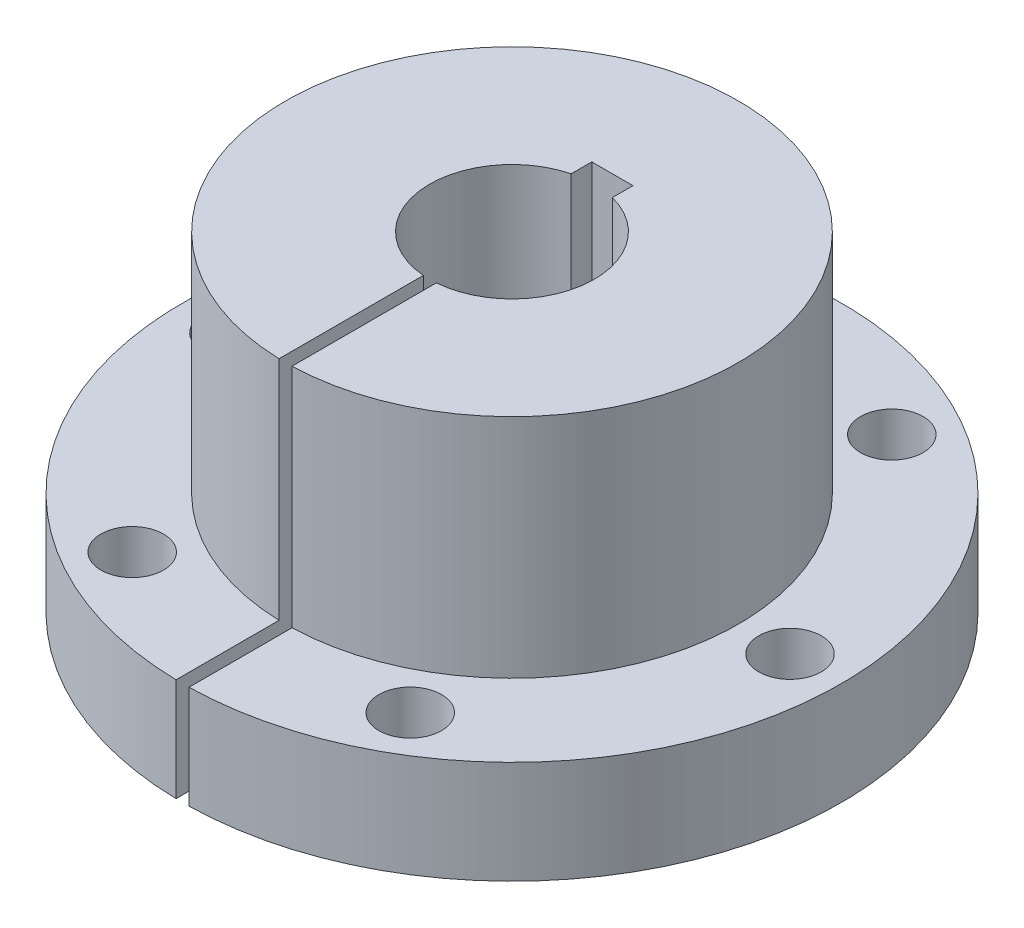
from build123d import *

# Parameters (mm, degrees)
SKETCH1_R           = 25.4
BOSS_EXTRUDE1_DEPTH = 7.9375
SKETCH2_R           = 17.4625
BOSS_EXTRUDE2_DEPTH = 17.4625
CUT_EXTRUDE1_DEPTH  = 44.994090512
SKETCH4_R           = 2.413
CUT_EXTRUDE2_DEPTH  = 40.940692361
CIRPATTERN1_COUNT   = 6


with BuildPart() as part:
    # Sketch1 → Boss-Extrude1 (new body)
    with BuildSketch(Plane(origin=(0, 0, 0), x_dir=(1, 0, 0), z_dir=(0, 1, 0))):
        with Locations(Location((0, 0, 0), (0, 0, 270))):
            Circle(SKETCH1_R)
    extrude(amount=BOSS_EXTRUDE1_DEPTH)

    # Sketch2 → Boss-Extrude2 (add)
    with BuildSketch(Plane(origin=(0, 7.9375, 0), x_dir=(1, 0, 0), z_dir=(0, 1, 0))):
        with Locations(Location((0, 0, 0), (0, 0, 270))):
            Circle(SKETCH2_R)
    extrude(amount=BOSS_EXTRUDE2_DEPTH)

    # Sketch3 → Cut-Extrude1 (cut, through all)
    with BuildSketch(Plane(origin=(0, 25.4, 0), x_dir=(1, 0, 0), z_dir=(0, 1, 0))):
        with BuildLine():
            Line((-1.5875, 7.735861062), (1.5875, 7.735861062))
            Line((1.5875, 7.735861062), (1.5875, 6.148361062))
            ThreePointArc((1.5875, 6.148361062), (6.326022598, -0.551305799), (0.5, -6.330284354))
            Line((0.5, -6.330284354), (0.5, -25.4))
            Line((0.5, -25.4), (-0.5, -25.4))
            Line((-0.5, -25.4), (-0.5, -6.330284354))
            ThreePointArc((-0.5, -6.330284354), (-6.326022598, -0.551305799), (-1.5875, 6.148361062))
            Line((-1.5875, 6.148361062), (-1.5875, 7.735861062))
        make_face()
    extrude(amount=-CUT_EXTRUDE1_DEPTH, mode=Mode.SUBTRACT)

    # Sketch4 → Cut-Extrude2 (cut, through all)
    with BuildSketch(Plane(origin=(0, 7.9375, 0), x_dir=(1, 0, 0), z_dir=(0, 1, 0))):
        with Locations(Location((-21.43125, 0, 0), (0, 0, 270))):
            Circle(SKETCH4_R)
    cut_extrude2 = extrude(amount=-CUT_EXTRUDE2_DEPTH, mode=Mode.SUBTRACT)

    # CirPattern1: Cut-Extrude2 ×6 about axis
    cirpattern1_axis = Axis((0, 0, 0), (0, 1, 0))
    for i in range(1, CIRPATTERN1_COUNT):
        add(cut_extrude2.rotate(cirpattern1_axis, i * 360 / CIRPATTERN1_COUNT), mode=Mode.SUBTRACT)


solid = part.part
